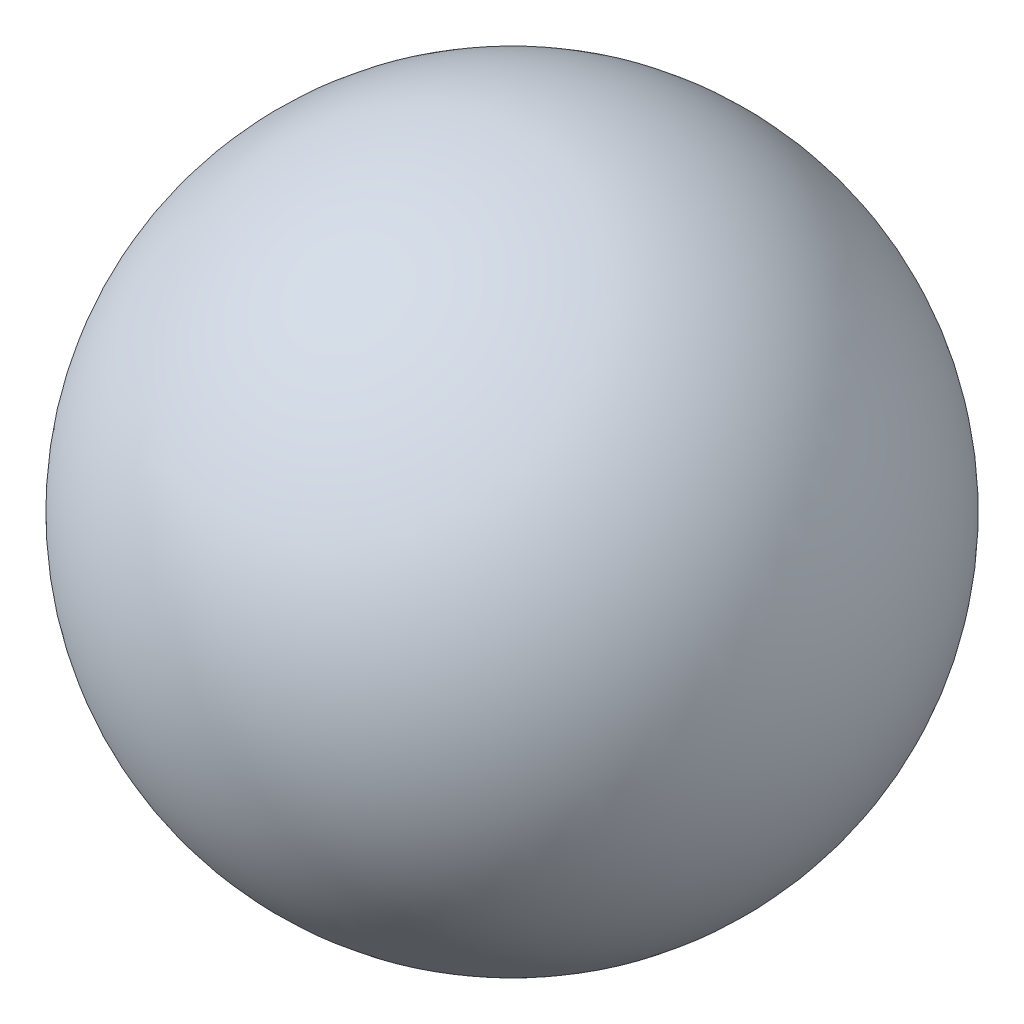
from build123d import *


with BuildPart() as part:
    # Sketch1 → Core (revolve)
    with BuildSketch(Plane.XY):
        with BuildLine():
            ThreePointArc((0, -7), (7, 0), (0, 7))
            Line((0, 7), (0, -7))
        make_face()
    revolve(axis=Axis((0, 7, 0), (0, -1, 0)))


with BuildPart() as body_2:
    # Sketch1<3> → Coating (revolve)
    with BuildSketch(Plane.XY):
        with BuildLine():
            Line((0, 8), (0, 7))
            ThreePointArc((0, 7), (7, 0), (0, -7))
            Line((0, -7), (0, -8))
            ThreePointArc((0, -8), (8, 0), (0, 8))
        make_face()
    revolve(axis=Axis((0, 7, 0), (0, -1, 0)))


solid = Compound([part.part, body_2.part])
